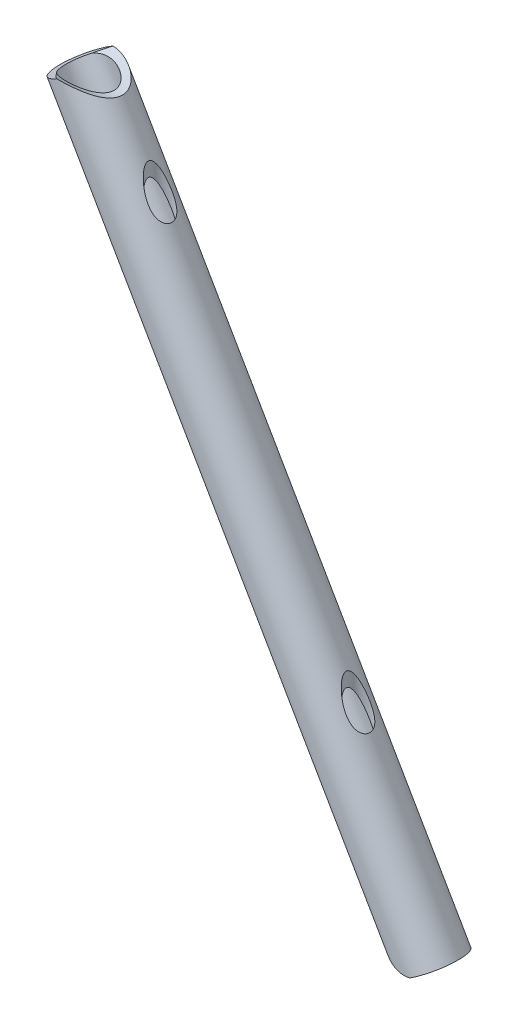
from build123d import *

# Parameters (mm, degrees)
SKETCH2_R               = 9.525
SKETCH2_R_2             = 7.112
CUT_EXTRUDE2_DEPTH      = 542
CUT_EXTRUDE2_DEPTH_BACK = 70
SKETCH4_R               = 4
CUT_EXTRUDE3_DEPTH      = 105
CUT_EXTRUDE3_DEPTH_BACK = 311
SKETCH5_R               = 15.875


with BuildPart() as part:
    # Sweep1: sweep along a path in Sketch1
    with BuildLine(Plane.XY) as sweep1_path:
        Line((0, 0), (-117.317574699, 203.2))
    # Sketch2 → Sweep1 (sweep)
    with BuildSketch(Plane(origin=(0, 0, 0), x_dir=(0, 0, 1), z_dir=(-0.5000000000000041, 0.8660254037844362, 0))):
        Circle(SKETCH2_R)
        Circle(SKETCH2_R_2, mode=Mode.SUBTRACT)
    sweep(path=sweep1_path.line)

    # Sketch4 → Cut-Extrude2 (cut, two sides: drawn at the far end of the back side and taken through both)
    with BuildSketch(Plane(origin=(0, 0, 0), x_dir=(1, 0, 0), z_dir=(0, 1, 0)).offset(-CUT_EXTRUDE2_DEPTH_BACK)):
        with Locations(Location((-25.4, 0, 0), (0, 0, 90))):
            Circle(SKETCH4_R)
        with Locations(Location((-91.92, 0, 0), (0, 0, 90))):
            Circle(SKETCH4_R)
    extrude(amount=CUT_EXTRUDE2_DEPTH + CUT_EXTRUDE2_DEPTH_BACK, mode=Mode.SUBTRACT)

    # Sketch5 → Cut-Extrude3 (cut, two sides: drawn at the far end of the back side and taken through both)
    with BuildSketch(Plane(origin=(0, 0, 0), x_dir=(0, 0, -1), z_dir=(1, 0, 0)).offset(-CUT_EXTRUDE3_DEPTH_BACK)):
        with Locations((0, -12)):
            Circle(SKETCH5_R)
        with Locations((0, 215.9625)):
            Circle(SKETCH5_R)
    extrude(amount=CUT_EXTRUDE3_DEPTH + CUT_EXTRUDE3_DEPTH_BACK, mode=Mode.SUBTRACT)


solid = part.part
